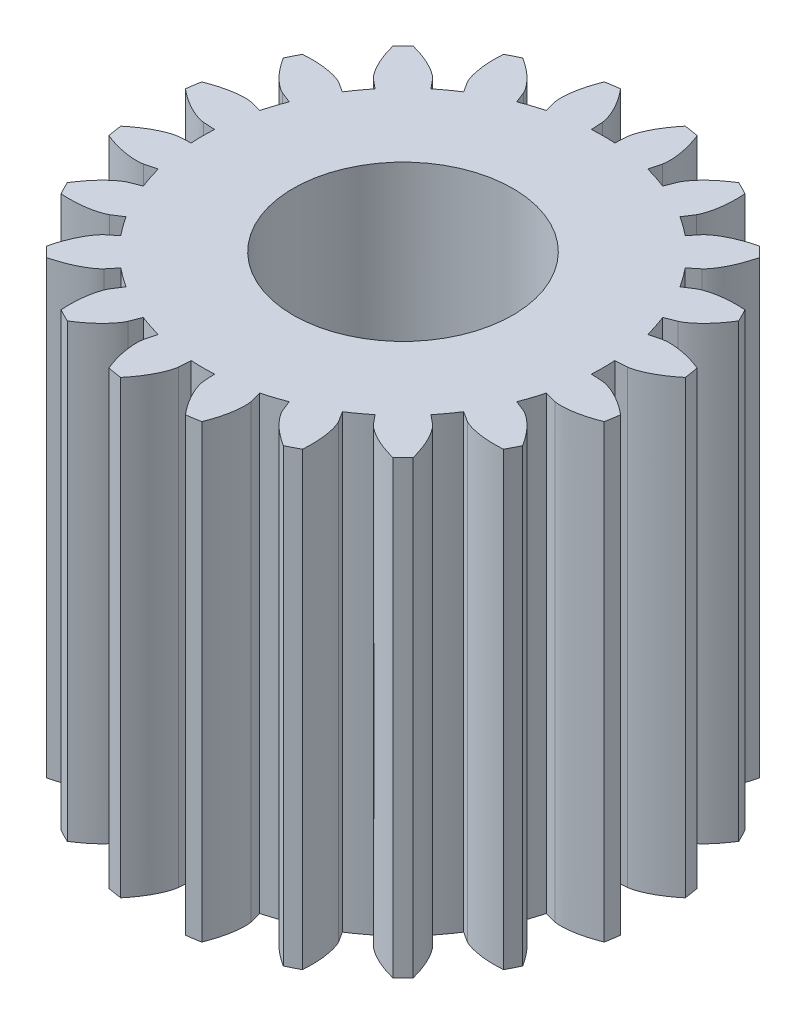
from build123d import *
from build123d.topology import SkipClean

# Parameters (mm, degrees)
SKETCH2_R           = 6.71
BOSS_EXTRUDE1_DEPTH = 12
CUT_EXTRUDE1_DEPTH  = 16.298633926
CIRPATTERN1_COUNT   = 20
SKETCH5_R           = 5.3375
BOSS_EXTRUDE3_DEPTH = 12
CUT_EXTRUDE4_DEPTH  = 12
CUT_EXTRUDE5_START  = -5.732
CUT_EXTRUDE5_DEPTH  = 10


with BuildPart() as part:
    # Sketch2 → Boss-Extrude1 (new body)
    with BuildSketch(Plane(origin=(0, 0, 0), x_dir=(1, 0, 0), z_dir=(0, 1, 0))):
        with Locations(Location((0, 0, 0), (0, 0, 270))):
            Circle(SKETCH2_R)
    extrude(amount=BOSS_EXTRUDE1_DEPTH)

    # Sketch3 → Cut-Extrude1 (cut, through all)
    with BuildSketch(Plane(origin=(0, 0, 0), x_dir=(1, 0, 0), z_dir=(0, 1, 0))):
        with BuildLine():
            add(Edge.make_bspline(
                [(-0.330599433, 5.64615099), (-0.332652246, 5.669327185), (-0.342211343, 5.720867704), (-0.366225101, 5.810792217), (-0.406897347, 5.926040246), (-0.470397178, 6.069742647), (-0.5614541, 6.238814731), (-0.684297086, 6.429635711), (-0.909735124, 6.726083935), (-1.117862459, 6.938793209), (-1.274154089, 7.077912861)],
                knots=[0, 0, 0, 0, 0.040001069, 0.090001149, 0.160001144, 0.250001075, 0.360000951, 0.49000078, 0.640000563, 1, 1, 1, 1], degree=3))
            ThreePointArc((-1.274154089, 7.077912861), (0, 7.191684025), (1.274154089, 7.077912861))
            add(Edge.make_bspline(
                [(0.330599433, 5.64615099), (0.332652246, 5.669327185), (0.342211343, 5.720867704), (0.366225101, 5.810792217), (0.406897347, 5.926040246), (0.470397178, 6.069742647), (0.5614541, 6.238814731), (0.684297086, 6.429635711), (0.909735124, 6.726083935), (1.117862459, 6.938793209), (1.274154089, 7.077912861)],
                knots=[0, 0, 0, 0, 0.040001069, 0.090001149, 0.160001144, 0.250001075, 0.360000951, 0.49000078, 0.640000563, 1, 1, 1, 1], degree=3))
            Line((0.330599433, 5.64615099), (0.311992603, 5.328373754))
            ThreePointArc((0.311992603, 5.328373754), (0, 5.3375), (-0.311992603, 5.328373754))
            Line((-0.311992603, 5.328373754), (-0.330599433, 5.64615099))
        make_face()
    cut_extrude1 = extrude(amount=CUT_EXTRUDE1_DEPTH, mode=Mode.SUBTRACT)

    # CirPattern1: Cut-Extrude1 ×20 about axis
    cirpattern1_axis = Axis((0, -2.8, 0), (0, 1, 0))
    for i in range(1, CIRPATTERN1_COUNT):
        add(cut_extrude1.rotate(cirpattern1_axis, i * 360 / CIRPATTERN1_COUNT), mode=Mode.SUBTRACT)

    # Sketch5 → Boss-Extrude3 (add)
    with BuildSketch(Plane(origin=(0, 0, 0), x_dir=(1, 0, 0), z_dir=(0, 1, 0))):
        Circle(SKETCH5_R)
    extrude(amount=BOSS_EXTRUDE3_DEPTH)

    # Sketch13 → Cut-Extrude4 (cut)
    with BuildSketch(Plane.XZ):
        with BuildLine():
            Line((2.637438406, -1.263162913), (1.705256209, 2.375660572))
            ThreePointArc((1.705256209, 2.375660572), (-2.832844545, -0.725709083), (2.637438406, -1.263162913))
        make_face()
    extrude(amount=-CUT_EXTRUDE4_DEPTH, mode=Mode.SUBTRACT)

    # Sketch14 → Cut-Extrude5 (cut)
    with SkipClean():  # the faces are left unmerged after this step: merging them gives an invalid solid
        with BuildSketch(Plane(origin=(0, 12, 0), x_dir=(1, 0, 0), z_dir=(0, 1, 0)).offset(CUT_EXTRUDE5_START)):
            with BuildLine():
                Line((2.637438406, 1.263162913), (1.705256209, -2.375660572))
                ThreePointArc((1.705256209, -2.375660572), (2.832844545, -0.725709083), (2.637438406, 1.263162913))
            make_face()
        extrude(amount=CUT_EXTRUDE5_DEPTH, mode=Mode.SUBTRACT)


solid = part.part
